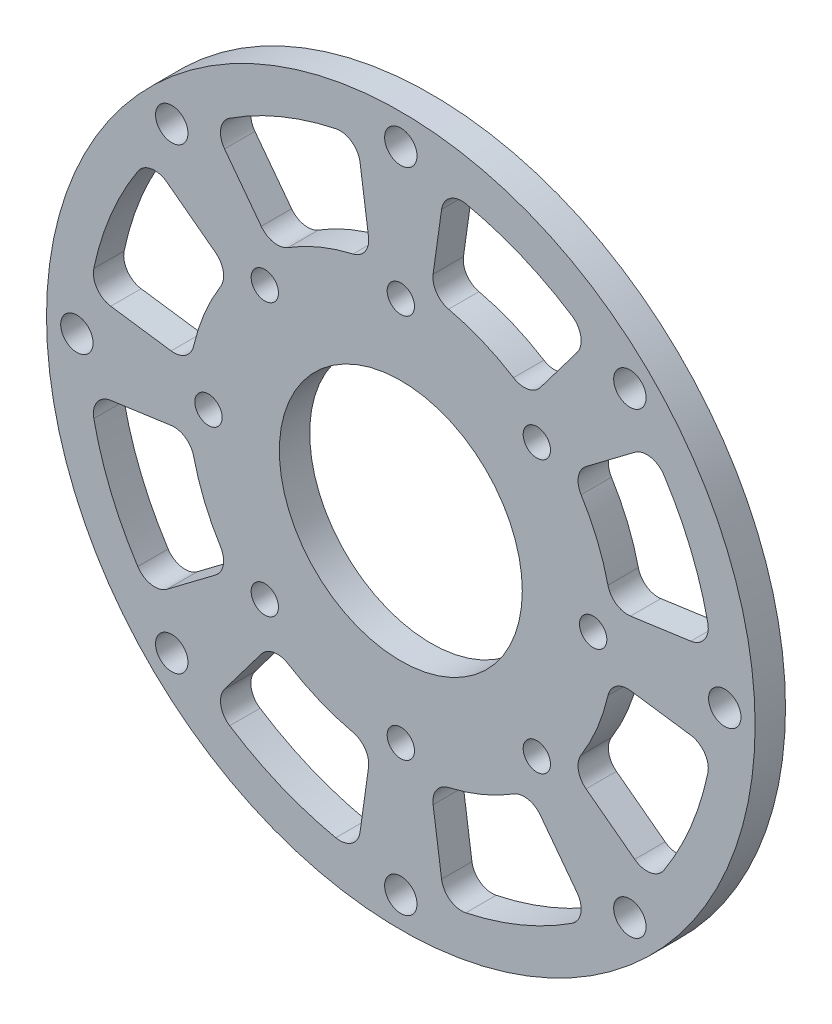
from build123d import *

# Parameters (mm, degrees)
SKETCH_1_R          = 35
SKETCH_1_R_2        = 1.6
SKETCH_1_R_3        = 1.35
SKETCH_1_R_4        = 12
EXTRUDE_1_DEPTH     = 3
CUT_EXTRUDE_1_DEPTH = 3


with BuildPart() as part:
    # 草图1 → 凸台-拉伸1 (new body)
    with BuildSketch(Plane.XY):
        Circle(SKETCH_1_R)
        with Locations((-22.627416998, 22.627416998)):
            Circle(SKETCH_1_R_2, mode=Mode.SUBTRACT)
        with Locations((0, 32)):
            Circle(SKETCH_1_R_2, mode=Mode.SUBTRACT)
        with Locations((22.627416998, 22.627416998)):
            Circle(SKETCH_1_R_2, mode=Mode.SUBTRACT)
        with Locations((32, 0)):
            Circle(SKETCH_1_R_2, mode=Mode.SUBTRACT)
        with Locations((22.627416998, -22.627416998)):
            Circle(SKETCH_1_R_2, mode=Mode.SUBTRACT)
        with Locations((0, -32)):
            Circle(SKETCH_1_R_2, mode=Mode.SUBTRACT)
        with Locations((-22.627416998, -22.627416998)):
            Circle(SKETCH_1_R_2, mode=Mode.SUBTRACT)
        with Locations((-32, 0)):
            Circle(SKETCH_1_R_2, mode=Mode.SUBTRACT)
        with Locations((-13.435028843, 13.435028843)):
            Circle(SKETCH_1_R_3, mode=Mode.SUBTRACT)
        with Locations((0, 19)):
            Circle(SKETCH_1_R_3, mode=Mode.SUBTRACT)
        with Locations((13.435028843, 13.435028843)):
            Circle(SKETCH_1_R_3, mode=Mode.SUBTRACT)
        with Locations((19, 0)):
            Circle(SKETCH_1_R_3, mode=Mode.SUBTRACT)
        with Locations((13.435028843, -13.435028843)):
            Circle(SKETCH_1_R_3, mode=Mode.SUBTRACT)
        with Locations((0, -19)):
            Circle(SKETCH_1_R_3, mode=Mode.SUBTRACT)
        with Locations((-13.435028843, -13.435028843)):
            Circle(SKETCH_1_R_3, mode=Mode.SUBTRACT)
        with Locations((-19, 0)):
            Circle(SKETCH_1_R_3, mode=Mode.SUBTRACT)
        Circle(SKETCH_1_R_4, mode=Mode.SUBTRACT)
    extrude(amount=EXTRUDE_1_DEPTH)

    # 草图2 → 切除-拉伸1 (cut)
    with BuildSketch(Plane.XY.offset(3)):
        with BuildLine():
            Line((4.026410343, 28.649398244), (3.188856349, 22.689891917))
            ThreePointArc((3.188856349, 22.689891917), (3.521253388, 21.278568437), (4.719880097, 20.462715652))
            ThreePointArc((4.719880097, 20.462715652), (8.03635208, 19.401470183), (11.131865777, 17.806784222))
            ThreePointArc((11.131865777, 17.806784222), (12.556317887, 17.536122185), (13.78931449, 18.299038387))
            Line((13.78931449, 18.299038387), (17.411081718, 23.105285833))
            ThreePointArc((17.411081718, 23.105285833), (17.783563729, 24.655431386), (16.904418332, 25.985392836))
            ThreePointArc((16.904418332, 25.985392836), (11.863186403, 28.640265508), (6.421218651, 30.327676321))
            ThreePointArc((6.421218651, 30.327676321), (4.85914422, 30.008901233), (4.026410343, 28.649398244))
        make_face()
        with BuildLine():
            Line((23.105285833, 17.411081718), (18.299038387, 13.78931449))
            ThreePointArc((18.299038387, 13.78931449), (17.536122185, 12.556317887), (17.806784222, 11.131865777))
            ThreePointArc((17.806784222, 11.131865777), (19.401470183, 8.03635208), (20.462715652, 4.719880097))
            ThreePointArc((20.462715652, 4.719880097), (21.278568437, 3.521253388), (22.689891917, 3.188856349))
            Line((22.689891917, 3.188856349), (28.649398244, 4.026410343))
            ThreePointArc((28.649398244, 4.026410343), (30.008901233, 4.85914422), (30.327676321, 6.421218651))
            ThreePointArc((30.327676321, 6.421218651), (28.640265508, 11.863186403), (25.985392836, 16.904418332))
            ThreePointArc((25.985392836, 16.904418332), (24.655431386, 17.783563729), (23.105285833, 17.411081718))
        make_face()
        with BuildLine():
            Line((28.649398244, -4.026410343), (22.689891917, -3.188856349))
            ThreePointArc((22.689891917, -3.188856349), (21.278568437, -3.521253388), (20.462715652, -4.719880097))
            ThreePointArc((20.462715652, -4.719880097), (19.401470183, -8.03635208), (17.806784222, -11.131865777))
            ThreePointArc((17.806784222, -11.131865777), (17.536122185, -12.556317887), (18.299038387, -13.78931449))
            Line((18.299038387, -13.78931449), (23.105285833, -17.411081718))
            ThreePointArc((23.105285833, -17.411081718), (24.655431386, -17.783563729), (25.985392836, -16.904418332))
            ThreePointArc((25.985392836, -16.904418332), (28.640265508, -11.863186403), (30.327676321, -6.421218651))
            ThreePointArc((30.327676321, -6.421218651), (30.008901233, -4.85914422), (28.649398244, -4.026410343))
        make_face()
        with BuildLine():
            Line((17.411081718, -23.105285833), (13.78931449, -18.299038387))
            ThreePointArc((13.78931449, -18.299038387), (12.556317887, -17.536122185), (11.131865777, -17.806784222))
            ThreePointArc((11.131865777, -17.806784222), (8.03635208, -19.401470183), (4.719880097, -20.462715652))
            ThreePointArc((4.719880097, -20.462715652), (3.521253388, -21.278568437), (3.188856349, -22.689891917))
            Line((3.188856349, -22.689891917), (4.026410343, -28.649398244))
            ThreePointArc((4.026410343, -28.649398244), (4.85914422, -30.008901233), (6.421218651, -30.327676321))
            ThreePointArc((6.421218651, -30.327676321), (11.863186403, -28.640265508), (16.904418332, -25.985392836))
            ThreePointArc((16.904418332, -25.985392836), (17.783563729, -24.655431386), (17.411081718, -23.105285833))
        make_face()
        with BuildLine():
            Line((-4.026410343, -28.649398244), (-3.188856349, -22.689891917))
            ThreePointArc((-3.188856349, -22.689891917), (-3.521253388, -21.278568437), (-4.719880097, -20.462715652))
            ThreePointArc((-4.719880097, -20.462715652), (-8.03635208, -19.401470183), (-11.131865777, -17.806784222))
            ThreePointArc((-11.131865777, -17.806784222), (-12.556317887, -17.536122185), (-13.78931449, -18.299038387))
            Line((-13.78931449, -18.299038387), (-17.411081718, -23.105285833))
            ThreePointArc((-17.411081718, -23.105285833), (-17.783563729, -24.655431386), (-16.904418332, -25.985392836))
            ThreePointArc((-16.904418332, -25.985392836), (-11.863186403, -28.640265508), (-6.421218651, -30.327676321))
            ThreePointArc((-6.421218651, -30.327676321), (-4.85914422, -30.008901233), (-4.026410343, -28.649398244))
        make_face()
        with BuildLine():
            Line((-23.105285833, -17.411081718), (-18.299038387, -13.78931449))
            ThreePointArc((-18.299038387, -13.78931449), (-17.536122185, -12.556317887), (-17.806784222, -11.131865777))
            ThreePointArc((-17.806784222, -11.131865777), (-19.401470183, -8.03635208), (-20.462715652, -4.719880097))
            ThreePointArc((-20.462715652, -4.719880097), (-21.278568437, -3.521253388), (-22.689891917, -3.188856349))
            Line((-22.689891917, -3.188856349), (-28.649398244, -4.026410343))
            ThreePointArc((-28.649398244, -4.026410343), (-30.008901233, -4.85914422), (-30.327676321, -6.421218651))
            ThreePointArc((-30.327676321, -6.421218651), (-28.640265508, -11.863186403), (-25.985392836, -16.904418332))
            ThreePointArc((-25.985392836, -16.904418332), (-24.655431386, -17.783563729), (-23.105285833, -17.411081718))
        make_face()
        with BuildLine():
            Line((-28.649398244, 4.026410343), (-22.689891917, 3.188856349))
            ThreePointArc((-22.689891917, 3.188856349), (-21.278568437, 3.521253388), (-20.462715652, 4.719880097))
            ThreePointArc((-20.462715652, 4.719880097), (-19.401470183, 8.03635208), (-17.806784222, 11.131865777))
            ThreePointArc((-17.806784222, 11.131865777), (-17.536122185, 12.556317887), (-18.299038387, 13.78931449))
            Line((-18.299038387, 13.78931449), (-23.105285833, 17.411081718))
            ThreePointArc((-23.105285833, 17.411081718), (-24.655431386, 17.783563729), (-25.985392836, 16.904418332))
            ThreePointArc((-25.985392836, 16.904418332), (-28.640265508, 11.863186403), (-30.327676321, 6.421218651))
            ThreePointArc((-30.327676321, 6.421218651), (-30.008901233, 4.85914422), (-28.649398244, 4.026410343))
        make_face()
        with BuildLine():
            Line((-17.411081718, 23.105285833), (-13.78931449, 18.299038387))
            ThreePointArc((-13.78931449, 18.299038387), (-12.556317887, 17.536122185), (-11.131865777, 17.806784222))
            ThreePointArc((-11.131865777, 17.806784222), (-8.03635208, 19.401470183), (-4.719880097, 20.462715652))
            ThreePointArc((-4.719880097, 20.462715652), (-3.521253388, 21.278568437), (-3.188856349, 22.689891917))
            Line((-3.188856349, 22.689891917), (-4.026410343, 28.649398244))
            ThreePointArc((-4.026410343, 28.649398244), (-4.85914422, 30.008901233), (-6.421218651, 30.327676321))
            ThreePointArc((-6.421218651, 30.327676321), (-11.863186403, 28.640265508), (-16.904418332, 25.985392836))
            ThreePointArc((-16.904418332, 25.985392836), (-17.783563729, 24.655431386), (-17.411081718, 23.105285833))
        make_face()
    extrude(amount=-CUT_EXTRUDE_1_DEPTH, mode=Mode.SUBTRACT)


solid = part.part
